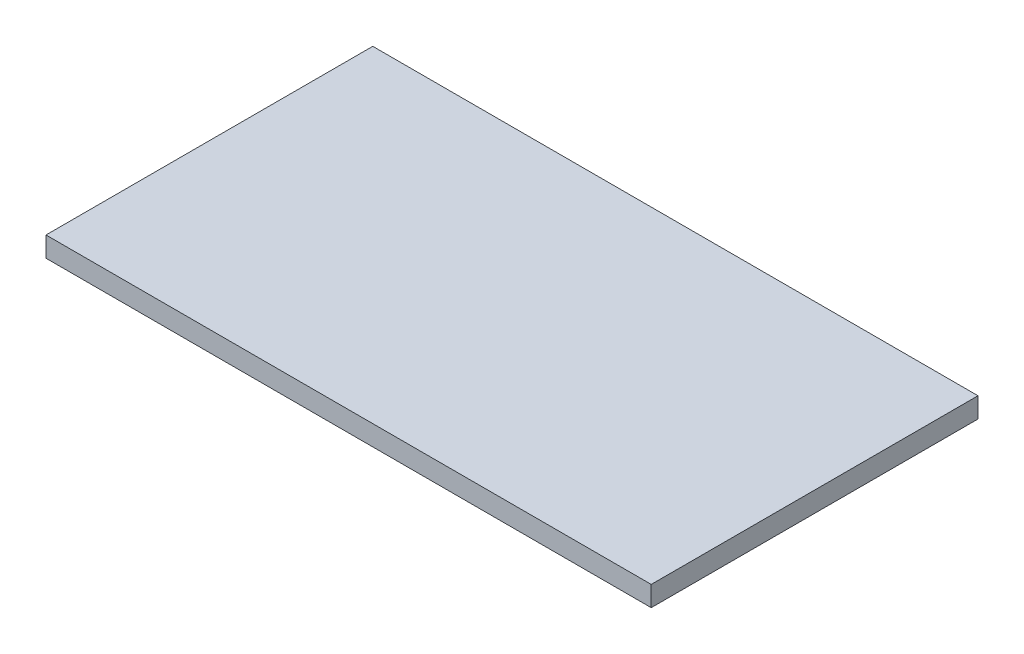
from build123d import *

# Parameters (mm, degrees)
SKETCH_1_W      = 150
SKETCH_1_H      = 80.98517055
EXTRUDE_1_DEPTH = 5


with BuildPart() as part:
    # Эскиз1 → Вытянуть1 (new body)
    with BuildSketch(Plane(origin=(0, 0, 0), x_dir=(1, 0, 0), z_dir=(0, 1, 0))):
        with Locations((75, 9.055471234)):
            Rectangle(SKETCH_1_W, SKETCH_1_H)
    extrude(amount=EXTRUDE_1_DEPTH)


solid = part.part
